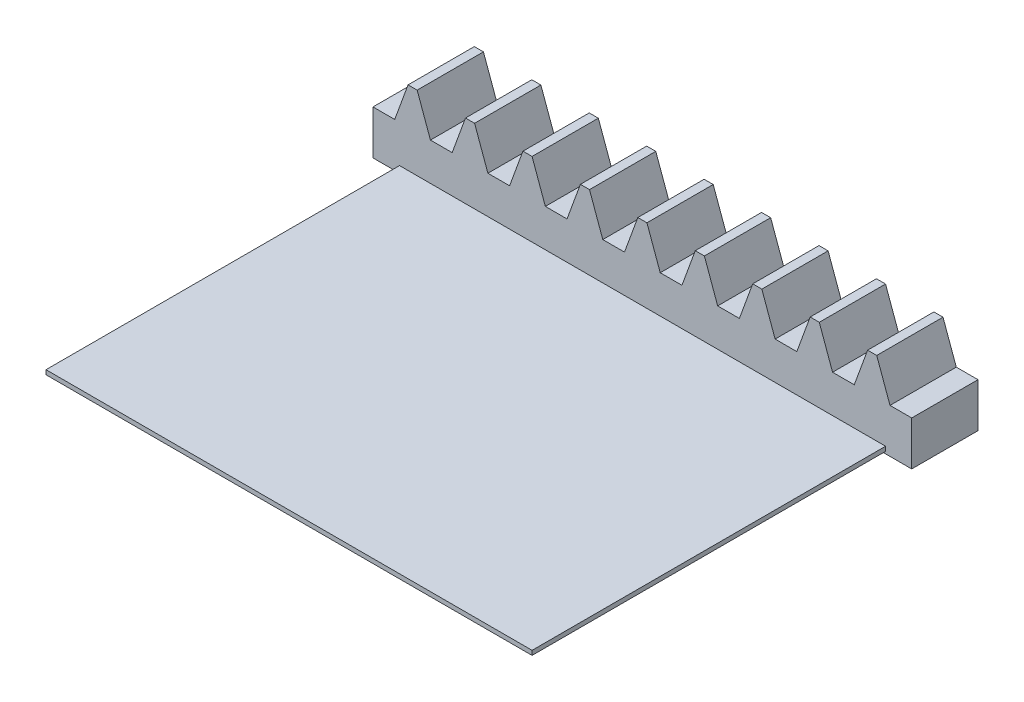
from build123d import *

# Parameters (mm, degrees)
BOSS_EXTRUDE1_DEPTH = 15
SKETCH2_W           = 110
SKETCH2_H           = 1
BOSS_EXTRUDE3_DEPTH = 80


with BuildPart() as part:
    # Sketch1 → Boss-Extrude1 (new body)
    with BuildSketch(Plane.XY):
        Polygon((0, 0), (4.913259174, 0), (7.93055075, 8.289940472), (9.992855173, 8.289940472), (13, 0), (17.913259174, 0), (20.93055075, 8.289940472), (22.992855173, 8.289940472), (26, 0), (30.913259174, 0), (33.93055075, 8.289940472), (35.992855173, 8.289940472), (39, 0), (43.913259174, 0), (46.93055075, 8.289940472), (48.992855173, 8.289940472), (52, 0), (56.913259174, 0), (59.93055075, 8.289940472), (61.992855173, 8.289940472), (65, 0), (69.913259174, 0), (72.93055075, 8.289940472), (74.992855173, 8.289940472), (78, 0), (82.913259174, 0), (85.93055075, 8.289940472), (87.992855173, 8.289940472), (91, 0), (95.913259174, 0), (98.93055075, 8.289940472), (100.992855173, 8.289940472), (104, 0), (108.913259174, 0), (111.93055075, 8.289940472), (113.992855173, 8.289940472), (117, 0), (121.913259174, 0), (121.913259174, -10), (0, -10), align=None)
    extrude(amount=BOSS_EXTRUDE1_DEPTH)

    # Sketch2 → Boss-Extrude3 (add)
    with BuildSketch(Plane.XY.offset(15)):
        with Locations((61, -9)):
            Rectangle(SKETCH2_W, SKETCH2_H)
    extrude(amount=BOSS_EXTRUDE3_DEPTH)


solid = part.part
